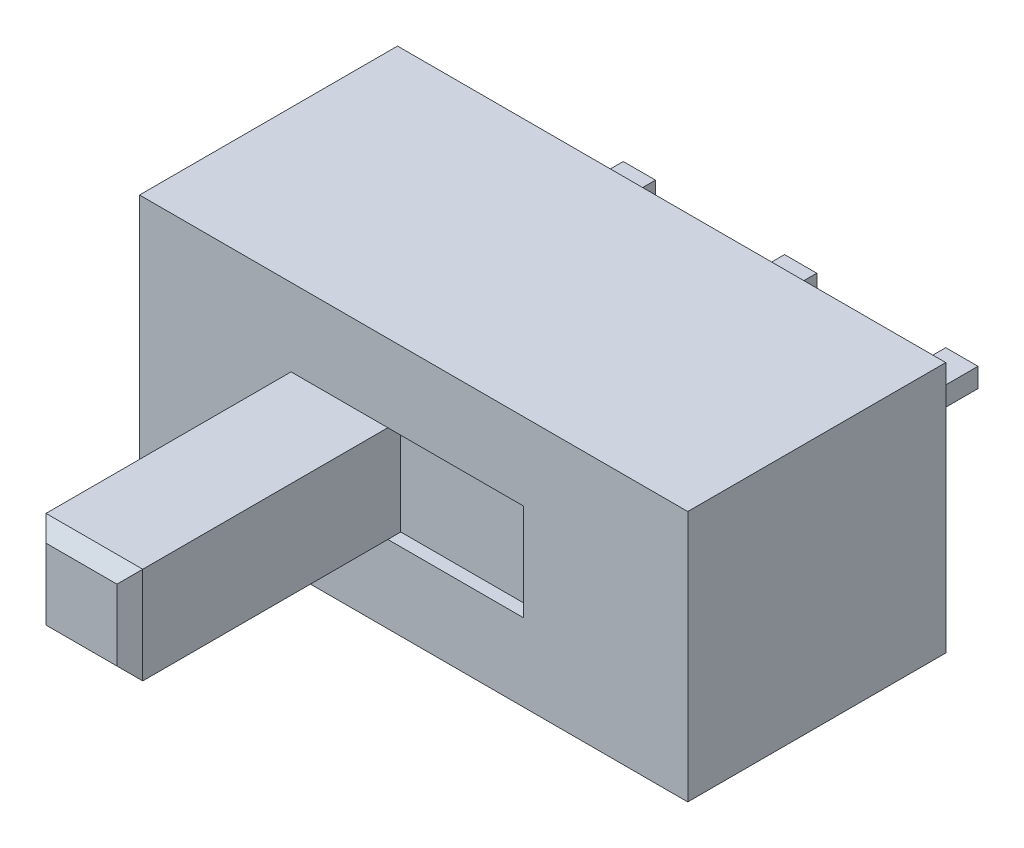
from build123d import *

# Parameters (mm, degrees)
SKETCH1_W           = 8.5
SKETCH1_H           = 3.9
BOSS_EXTRUDE1_DEPTH = 4
SKETCH2_W           = 1.5
SKETCH2_H           = 1.5
BOSS_EXTRUDE2_DEPTH = 4
CHAMFER1_SIZE       = 0.2
SKETCH3_W           = 2.1
SKETCH3_H           = 1.5
CUT_EXTRUDE1_DEPTH  = 0.2
SKETCH4_W           = 0.5
SKETCH4_H           = 0.3
BOSS_EXTRUDE3_DEPTH = 2


with BuildPart() as part:
    # Sketch1 → Boss-Extrude1 (new body)
    with BuildSketch(Plane.XY):
        Rectangle(SKETCH1_W, SKETCH1_H)
    extrude(amount=BOSS_EXTRUDE1_DEPTH)

    # Sketch2 → Boss-Extrude2 (add)
    with BuildSketch(Plane.XY.offset(4)):
        with Locations((-1.15, 0)):
            Rectangle(SKETCH2_W, SKETCH2_H)
    extrude(amount=BOSS_EXTRUDE2_DEPTH)

    # Chamfer1
    chamfer1_edges = [part.edges().sort_by_distance(p)[0] for p in [
        (-0.4, 0, 8),
        (-1.15, 0.75, 8),
        (-1.9, 0, 8),
        (-1.15, -0.75, 8),
    ]]
    chamfer(chamfer1_edges, length=CHAMFER1_SIZE)

    # Sketch3 → Cut-Extrude1 (cut)
    with BuildSketch(Plane.XY.offset(4)):
        with Locations((0.65, 0)):
            Rectangle(SKETCH3_W, SKETCH3_H)
    extrude(amount=-CUT_EXTRUDE1_DEPTH, mode=Mode.SUBTRACT)

    # Sketch4 → Boss-Extrude3 (add)
    with BuildSketch(Plane(origin=(0, 0, 0), x_dir=(-1, 0, 0), z_dir=(0, 0, -1))):
        Rectangle(SKETCH4_W, SKETCH4_H)
        with Locations((2.5, 0)):
            Rectangle(SKETCH4_W, SKETCH4_H)
        with Locations((-2.5, 0)):
            Rectangle(SKETCH4_W, SKETCH4_H)
    extrude(amount=BOSS_EXTRUDE3_DEPTH)


solid = part.part
